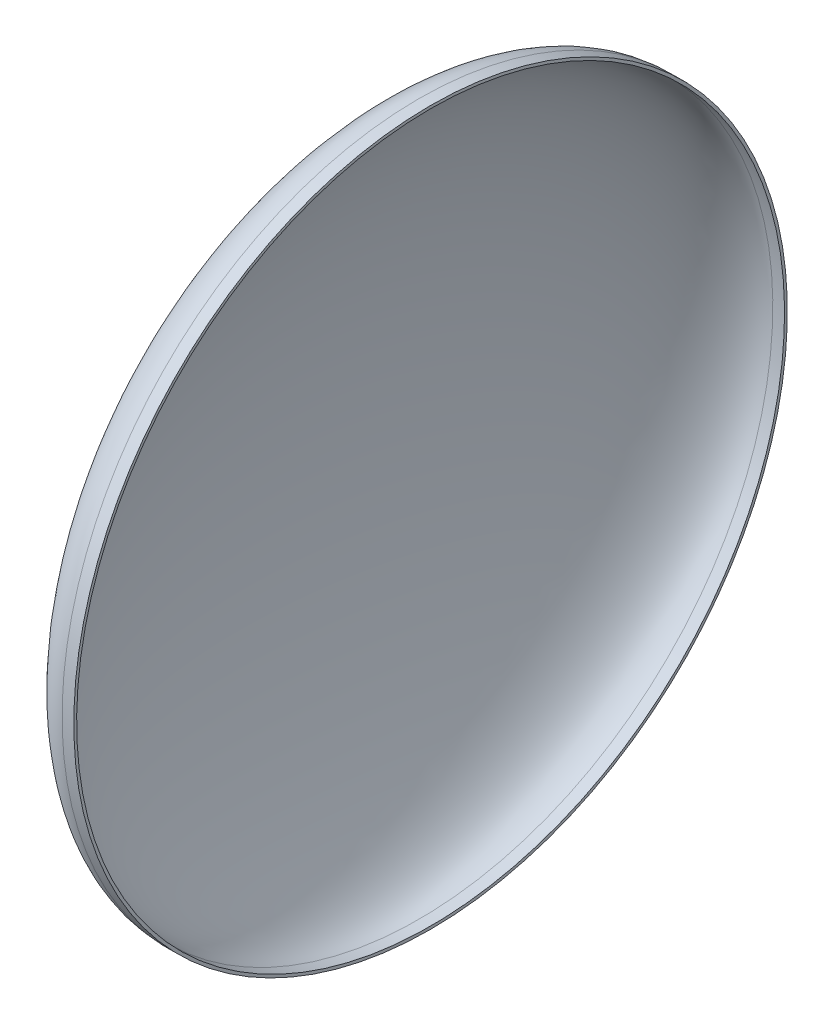
from build123d import *


with BuildPart() as part:
    # Sketch1 → Revolve1 (revolve)
    with BuildSketch(Plane.XY):
        with BuildLine():
            Line((0, 1520), (-50, 1520))
            add(Edge.make_bspline(
                [(-50, 1520), (-500, 1520), (-500, 0)],
                knots=[0, 0, 0, 1.570796327, 1.570796327, 1.570796327], degree=2, weights=[1, 0.707106781, 1]))
            Line((-500, 0), (-488, 0))
            add(Edge.make_bspline(
                [(-50, 1508), (-53.353518062, 1508), (-60.04825029, 1507.72241341), (-73.467061213, 1506.053909281), (-90.29580941, 1501.86735232), (-110.633378238, 1493.405543644), (-137.908506735, 1477.436074764), (-172.131400993, 1448.543542669), (-212.651682427, 1399.618686154), (-251.93075683, 1336.896502633), (-289.4122859, 1261.031831297), (-324.631860887, 1172.812414762), (-368.048388683, 1039.918006955), (-405.434365171, 886.074191628), (-435.646081686, 715.804921582), (-454.500683422, 581.158180706), (-469.361255722, 440.871617068), (-480.081803606, 296.311452026), (-485.477222347, 173.446633853), (-487.639314382, 74.442663514), (-488, 24.803439634), (-488, 0)],
                knots=[0, 0, 0, 0, 0.024543693, 0.049087385, 0.09817477, 0.147262156, 0.196349541, 0.294524311, 0.392699082, 0.490873852, 0.589048623, 0.687223393, 0.785398163, 0.981747704, 1.079922475, 1.178097245, 1.276272016, 1.374446786, 1.472621556, 1.521708942, 1.570796327, 1.570796327, 1.570796327, 1.570796327], degree=3))
            Line((-50, 1508), (0, 1508))
            Line((0, 1508), (0, 1520))
        make_face()
    revolve(axis=Axis((0, 0, 0), (-1, 0, 0)))


solid = part.part
